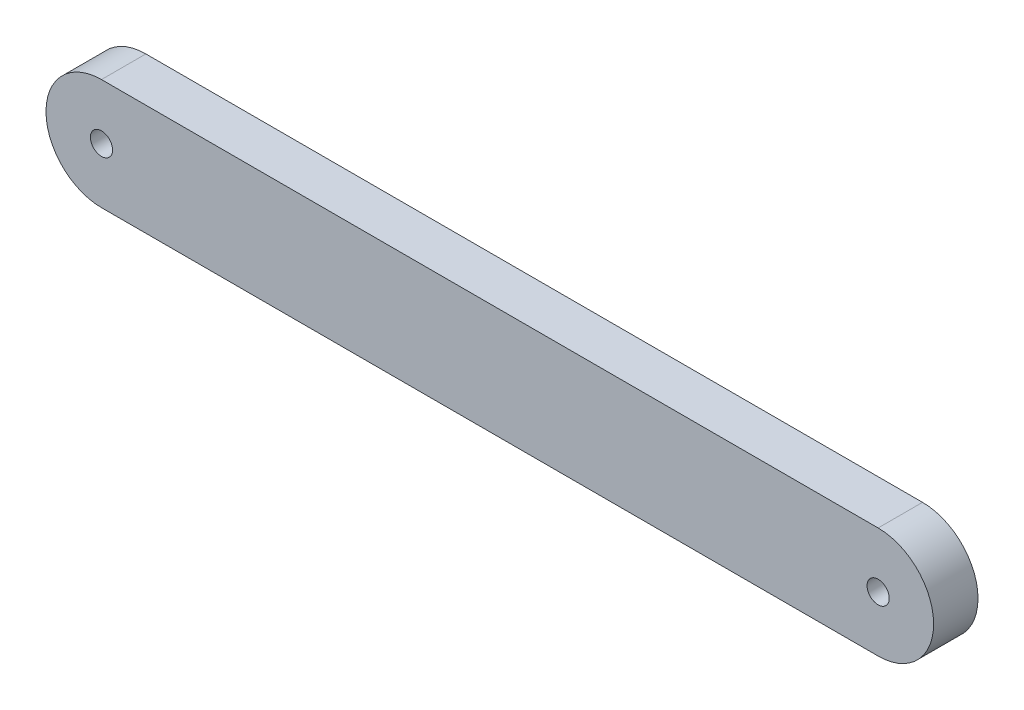
from build123d import *

# Parameters (mm, degrees)
BOSS_EXTRUDE1_DEPTH = 50.8
SKETCH2_R           = 12.7
CUT_EXTRUDE1_DEPTH  = 515.467579153


with BuildPart() as part:
    # Sketch1 → Boss-Extrude1 (new body)
    with BuildSketch(Plane.XY):
        with BuildLine():
            Line((-444.5, 63.5), (444.5, 63.5))
            ThreePointArc((444.5, 63.5), (508, 0), (444.5, -63.5))
            Line((444.5, -63.5), (-444.5, -63.5))
            ThreePointArc((-444.5, -63.5), (-508, 0), (-444.5, 63.5))
        make_face()
    extrude(amount=BOSS_EXTRUDE1_DEPTH)

    # Sketch2 → Cut-Extrude1 (cut, through all)
    with BuildSketch(Plane(origin=(0, 0, 0), x_dir=(-1, 0, 0), z_dir=(0, 0, -1))):
        with Locations((444.5, 0)):
            Circle(SKETCH2_R)
        with Locations((-444.5, 0)):
            Circle(SKETCH2_R)
    extrude(amount=-CUT_EXTRUDE1_DEPTH, mode=Mode.SUBTRACT)


solid = part.part
